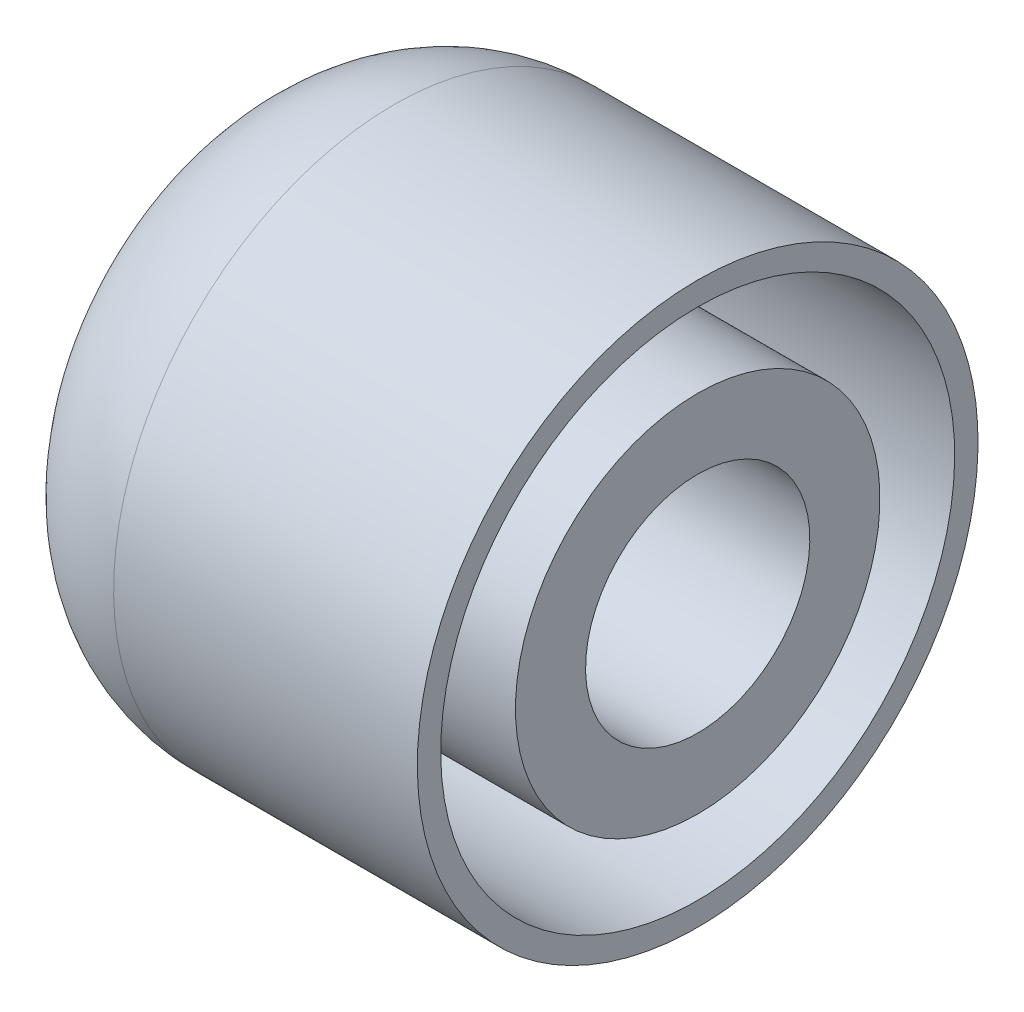
from build123d import *


with BuildPart() as part:
    # Sketch1 → Revolve1 (revolve)
    with BuildSketch(Plane.XY):
        with BuildLine():
            Line((0, 2.4), (-10, 2.4))
            Line((-10, 2.4), (-10, 2.5))
            ThreePointArc((-10, 2.5), (-8.974873734, 4.974873734), (-6.5, 6))
            Line((-6.5, 6), (0, 6))
            Line((0, 6), (0, 5.5))
            Line((0, 5.5), (-6, 5.5))
            Line((-6, 5.5), (-6, 3.9))
            Line((-6, 3.9), (0, 3.9))
            Line((0, 3.9), (0, 2.4))
        make_face()
    revolve(axis=Axis((0, 0, 0), (-1, 0, 0)))


solid = part.part
